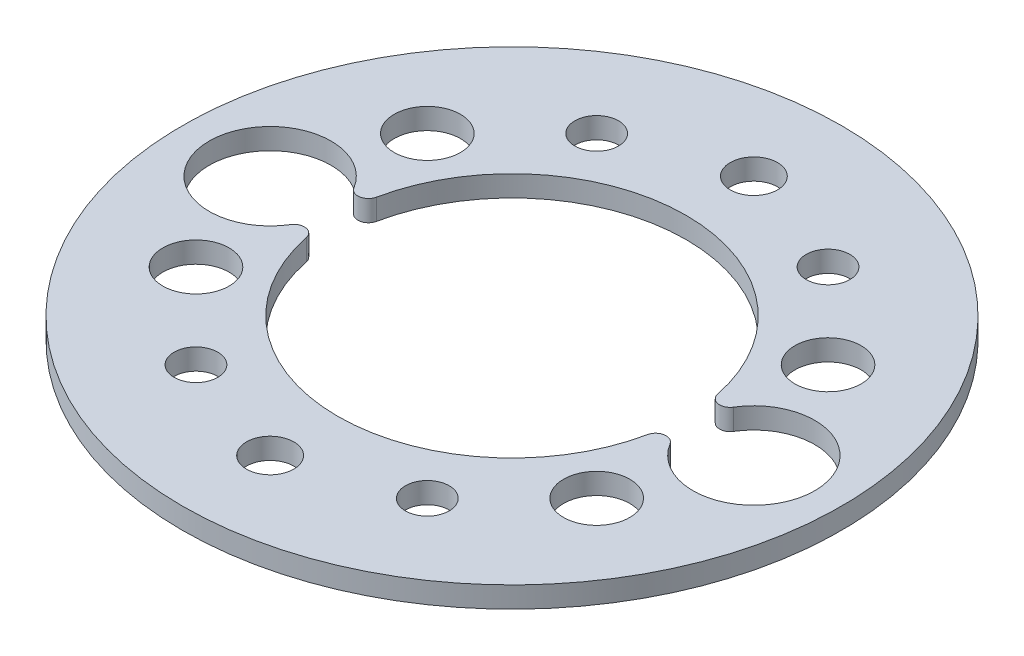
from build123d import *

# Parameters (mm, degrees)
SKETCH1_R           = 49.75
SKETCH1_R_2         = 3.571875
SKETCH1_R_3         = 5
SKETCH1_R_4         = 3.3
BOSS_EXTRUDE1_DEPTH = 3.175


with BuildPart() as part:
    # Sketch1 → Boss-Extrude1 (new body)
    with BuildSketch(Plane(origin=(0, 0, 0), x_dir=(1, 0, 0), z_dir=(0, 1, 0))):
        with Locations(Location((0, 0, 0), (0, 0, 270))):
            Circle(SKETCH1_R)
        with Locations(Location((0, 36.5125, 0), (0, 0, 270))):
            Circle(SKETCH1_R_2, mode=Mode.SUBTRACT)
        with Locations(Location((0, -36.5125, 0), (0, 0, 270))):
            Circle(SKETCH1_R_2, mode=Mode.SUBTRACT)
        with Locations(Location((30.245937227, -17.4625, 0), (0, 0, 270))):
            Circle(SKETCH1_R_3, mode=Mode.SUBTRACT)
        with Locations(Location((17.4625, 30.245937227, 0), (0, 0, 270))):
            Circle(SKETCH1_R_4, mode=Mode.SUBTRACT)
        with Locations(Location((-30.245937227, 17.4625, 0), (0, 0, 270))):
            Circle(SKETCH1_R_3, mode=Mode.SUBTRACT)
        with Locations(Location((-17.4625, 30.245937227, 0), (0, 0, 270))):
            Circle(SKETCH1_R_4, mode=Mode.SUBTRACT)
        with Locations(Location((-17.4625, -30.245937227, 0), (0, 0, 270))):
            Circle(SKETCH1_R_4, mode=Mode.SUBTRACT)
        with Locations(Location((17.4625, -30.245937227, 0), (0, 0, 270))):
            Circle(SKETCH1_R_4, mode=Mode.SUBTRACT)
        with Locations(Location((30.245937227, 17.4625, 0), (0, 0, 270))):
            Circle(SKETCH1_R_3, mode=Mode.SUBTRACT)
        with Locations(Location((-30.245937227, -17.4625, 0), (0, 0, 270))):
            Circle(SKETCH1_R_3, mode=Mode.SUBTRACT)
        with BuildLine():
            ThreePointArc((-25.748561188, -5.303123397), (0, -26.289), (25.748561188, -5.303123397))
            ThreePointArc((25.748561188, -5.303123397), (27.03087337, -4.059432148), (28.658299321, -4.796030566))
            ThreePointArc((28.658299321, -4.796030566), (45.7152375, 0), (28.658299321, 4.796030566))
            ThreePointArc((28.658299321, 4.796030566), (27.03087337, 4.059432148), (25.748561188, 5.303123397))
            ThreePointArc((25.748561188, 5.303123397), (0, 26.289), (-25.748561188, 5.303123397))
            ThreePointArc((-25.748561188, 5.303123397), (-27.03087337, 4.059432148), (-28.658299321, 4.796030566))
            ThreePointArc((-28.658299321, 4.796030566), (-45.7152375, 0), (-28.658299321, -4.796030566))
            ThreePointArc((-28.658299321, -4.796030566), (-27.03087337, -4.059432148), (-25.748561188, -5.303123397))
        make_face(mode=Mode.SUBTRACT)
    extrude(amount=BOSS_EXTRUDE1_DEPTH)


solid = part.part
